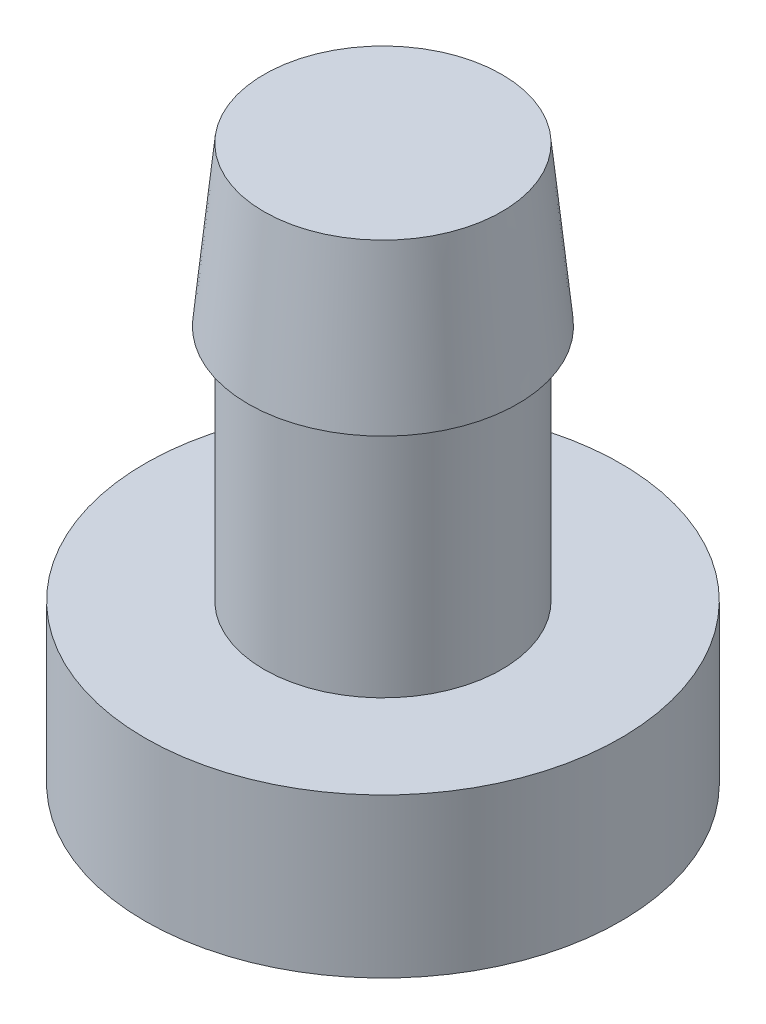
from build123d import *

# Parameters (mm, degrees)
SKETCH1_R           = 3
BOSS_EXTRUDE1_DEPTH = 2
SKETCH2_R           = 1.5
BOSS_EXTRUDE2_DEPTH = 5


with BuildPart() as part:
    # Sketch1 → Boss-Extrude1 (new body)
    with BuildSketch(Plane(origin=(0, 0, 0), x_dir=(1, 0, 0), z_dir=(0, 1, 0))):
        with Locations(Location((0, 0, 0), (0, 0, 270))):
            Circle(SKETCH1_R)
    extrude(amount=BOSS_EXTRUDE1_DEPTH)

    # Sketch2 → Boss-Extrude2 (add)
    with BuildSketch(Plane(origin=(0, 2, 0), x_dir=(1, 0, 0), z_dir=(0, 1, 0))):
        with Locations(Location((0, 0, 0), (0, 0, 270))):
            Circle(SKETCH2_R)
    extrude(amount=BOSS_EXTRUDE2_DEPTH)

    # Sketch3 → Revolve1 (revolve)
    with BuildSketch(Plane.XY, mode=Mode.PRIVATE) as revolve1_sk:
        Polygon((1.5, 7), (1.5, 5), (1.7, 5), align=None)
    revolve(revolve1_sk.sketch.rotate(Axis((0, 0, 0), (0, 1, 0)), 90), axis=Axis((0, 0, 0), (0, 1, 0)))


solid = part.part
